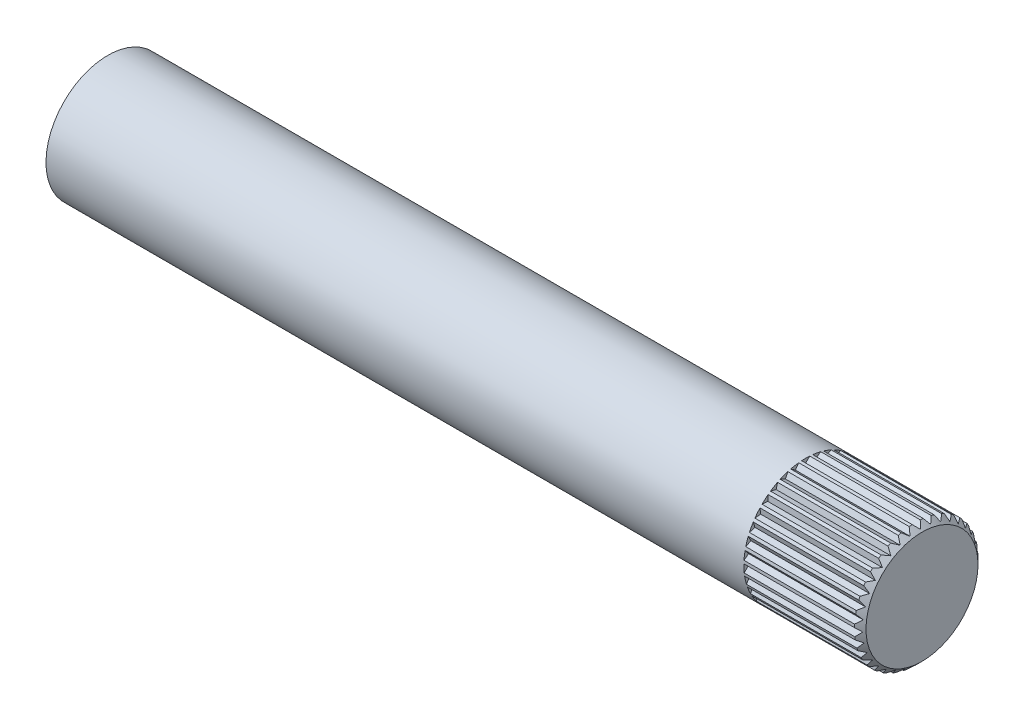
from build123d import *

# Parameters (mm, degrees)
SKETCH1_R           = 6.75
BOSS_EXTRUDE1_DEPTH = 88.9
CHAMFER1_SIZE       = 0.635
CUT_EXTRUDE1_DEPTH  = 12.7
CIRPATTERN2_COUNT   = 35


with BuildPart() as part:
    # Sketch1 → Boss-Extrude1 (new body)
    with BuildSketch(Plane(origin=(0, 0, 0), x_dir=(0, 0, -1), z_dir=(1, 0, 0))):
        Circle(SKETCH1_R)
    extrude(amount=BOSS_EXTRUDE1_DEPTH)

    # Chamfer1
    chamfer1_edges = [part.edges().sort_by_distance(p)[0] for p in [
        (88.9, 0, 6.75),
    ]]
    chamfer(chamfer1_edges, length=CHAMFER1_SIZE)

    # Sketch2 → Cut-Extrude1 (cut)
    with BuildSketch(Plane(origin=(88.9, 0, 0), x_dir=(0, 0, -1), z_dir=(1, 0, 0))):
        Polygon((-1.067952277, 7.359736044), (0, 6.291783767), (1.067952277, 7.359736044), align=None)
    cut_extrude1 = extrude(amount=-CUT_EXTRUDE1_DEPTH, mode=Mode.SUBTRACT)

    # CirPattern2: Cut-Extrude1 ×35 about axis
    cirpattern2_axis = Axis((88.9, 0, 0), (-1, 0, 0))
    for i in range(1, CIRPATTERN2_COUNT):
        add(cut_extrude1.rotate(cirpattern2_axis, i * 360 / CIRPATTERN2_COUNT), mode=Mode.SUBTRACT)


solid = part.part
